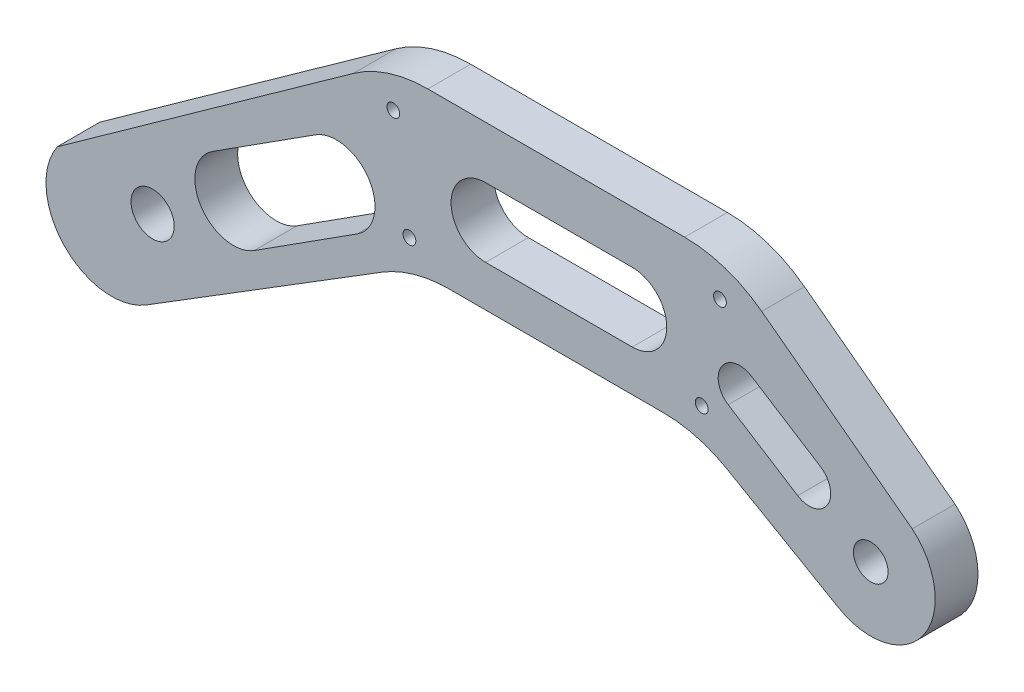
from build123d import *

# Parameters (mm, degrees)
SKETCH1_R           = 4.05
SKETCH1_R_2         = 1.5
SKETCH1_R_3         = 5.05
BOSS_EXTRUDE1_DEPTH = 10


with BuildPart() as part:
    # Sketch1 → Boss-Extrude1 (new body)
    with BuildSketch(Plane.XY):
        with BuildLine():
            Line((-36.50585994, 38), (23.49414006, 38))
            ThreePointArc((23.49414006, 38), (32.993428927, 36.45634395), (41.515142146, 31.984234067))
            Line((41.515142146, 31.984234067), (76.680353084, 5.562196244))
            ThreePointArc((76.680353084, 5.562196244), (79.334029485, -14.607546806), (59.473059994, -19.012365084))
            Line((59.473059994, -19.012365084), (33.489782569, -4.016722575))
            ThreePointArc((33.489782569, -4.016722575), (26.256281428, -1.021574208), (18.49414006, 0))
            Line((18.49414006, 0), (-31.50585994, 0))
            ThreePointArc((-31.50585994, 0), (-39.73032204, -1.149380887), (-47.324581503, -4.509451788))
            Line((-47.324581503, -4.509451788), (-102.315148598, -38.635060317))
            ThreePointArc((-102.315148598, -38.635060317), (-121.459805376, -36.232350563), (-123.106127076, -17.0078734))
            Line((-123.106127076, -17.0078734), (-53.947129798, 32.409057863))
            ThreePointArc((-53.947129798, 32.409057863), (-45.663596127, 36.56809178), (-36.50585994, 38))
        make_face()
        with Locations((66.99963225, -5.970908883)):
            Circle(SKETCH1_R, mode=Mode.SUBTRACT)
        with Locations((-44.575814379, 29.653127509)):
            Circle(SKETCH1_R_2, mode=Mode.SUBTRACT)
        with Locations((-40.818103787, 5.765583384)):
            Circle(SKETCH1_R_2, mode=Mode.SUBTRACT)
        with Locations((31.754938755, 29.566776323)):
            Circle(SKETCH1_R_2, mode=Mode.SUBTRACT)
        with Locations((27.4947716, 5.867993419)):
            Circle(SKETCH1_R_2, mode=Mode.SUBTRACT)
        with Locations((-100.821311964, -19.473430923)):
            Circle(SKETCH1_R_3, mode=Mode.SUBTRACT)
        with BuildLine():
            Line((-86.793889829, 0.207662569), (-62.735326509, 15.598189533))
            ThreePointArc((-62.735326509, 15.598189533), (-50.276491752, 12.860645223), (-53.014036062, 0.401810467))
            Line((-53.014036062, 0.401810467), (-77.072599382, -14.988716497))
            ThreePointArc((-77.072599382, -14.988716497), (-89.531434139, -12.251172188), (-86.793889829, 0.207662569))
        make_face(mode=Mode.SUBTRACT)
        with BuildLine():
            Line((-23.016668441, 25.777290149), (11.250740888, 25.781094638))
            ThreePointArc((11.250740888, 25.781094638), (19.317386003, 17.716240499), (11.252531864, 9.649595384))
            Line((11.252531864, 9.649595384), (-23.014877464, 9.645790894))
            ThreePointArc((-23.014877464, 9.645790894), (-31.08152258, 17.710645033), (-23.016668441, 25.777290149))
        make_face(mode=Mode.SUBTRACT)
        with BuildLine():
            Line((39.069043687, 17.688629392), (55.302205937, 7.399981644))
            ThreePointArc((55.302205937, 7.399981644), (56.858473261, 0.45660111), (49.915092727, -1.099666214))
            Line((49.915092727, -1.099666214), (33.681930477, 9.188981534))
            ThreePointArc((33.681930477, 9.188981534), (32.125663153, 16.132362067), (39.069043687, 17.688629392))
        make_face(mode=Mode.SUBTRACT)
    extrude(amount=BOSS_EXTRUDE1_DEPTH)


solid = part.part
